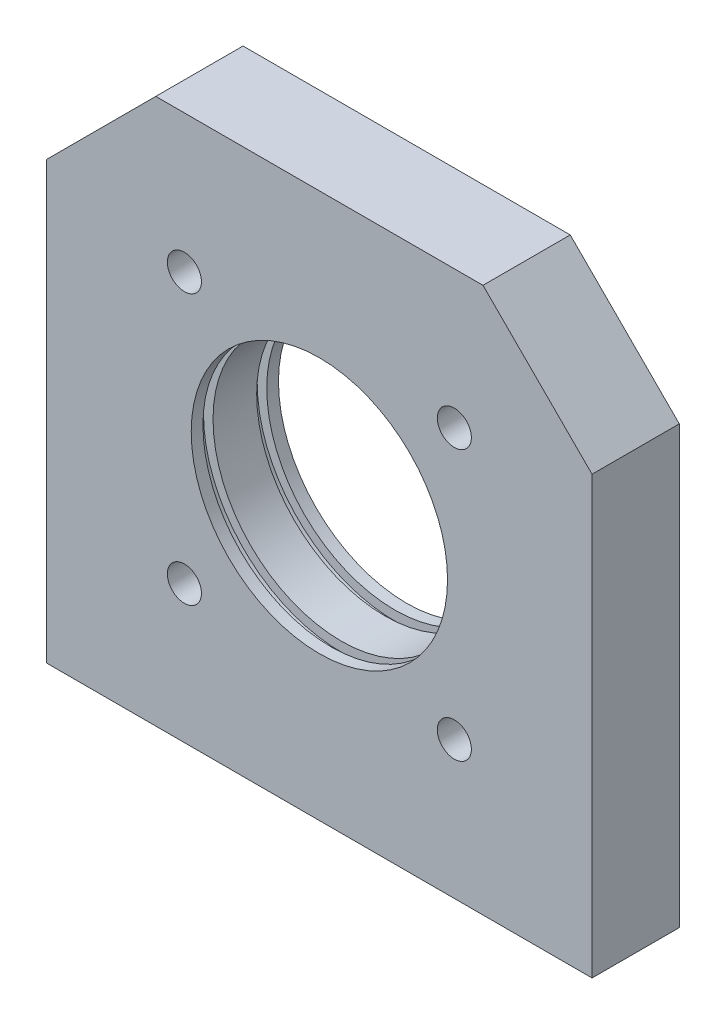
from build123d import *

# Parameters (mm, degrees)
SKETCH1_W                        = 100
SKETCH1_H                        = 100
BOSS_EXTRUDE1_DEPTH              = 16
CUT_EXTRUDE1_DEPTH               = 73.498275842
CUT_EXTRUDE1_DEPTH_BACK          = 73.498275842
SKETCH2_R                        = 23.5
SKETCH3_W                        = 1.85
SKETCH3_H                        = 1.75
TAP_DRILL_FOR_M6_HELICOIL1_D     = 6.25
TAP_DRILL_FOR_M6_HELICOIL1_DEPTH = 15
TAP_DRILL_FOR_M6_HELICOIL1_TIP   = 1.877689434
TAP_DRILL_FOR_M6_HELICOIL2_D     = 6.25
CHAMFER1_SIZE                    = 20


with BuildPart() as part:
    # Sketch1 → Boss-Extrude1 (new body)
    with BuildSketch(Plane.XY):
        Rectangle(SKETCH1_W, SKETCH1_H)
    extrude(amount=BOSS_EXTRUDE1_DEPTH)

    # Sketch2 → Cut-Extrude1 (cut, two sides: drawn at the far end of the back side and taken through both)
    with BuildSketch(Plane.XY.offset(16).offset(-CUT_EXTRUDE1_DEPTH_BACK)):
        Circle(SKETCH2_R)
    extrude(amount=CUT_EXTRUDE1_DEPTH + CUT_EXTRUDE1_DEPTH_BACK, mode=Mode.SUBTRACT)

    # Sketch3 → Cut-Revolve1 (revolve, cut)
    with BuildSketch(Plane(origin=(0, 0, 0), x_dir=(0, 0, -1), z_dir=(1, 0, 0)), mode=Mode.PRIVATE) as cut_revolve1_sk:
        with Locations((-12.925, 24.375)):
            Rectangle(SKETCH3_W, SKETCH3_H)
        with Locations((-3.075, 24.375)):
            Rectangle(SKETCH3_W, SKETCH3_H)
    revolve(cut_revolve1_sk.sketch.rotate(Axis((0, 0, 0), (0, 0, 1)), 90), axis=Axis((0, 0, 0), (0, 0, 1)), mode=Mode.SUBTRACT)

    # Tap Drill for M6 Helicoil1
    with Locations(Plane(origin=(0, -50, 0), x_dir=(-1, 0, 0), z_dir=(0, -1, 0))):
        with Locations((-40, -8), (0, -8), (40, -8)):
            Hole(TAP_DRILL_FOR_M6_HELICOIL1_D / 2, depth=TAP_DRILL_FOR_M6_HELICOIL1_DEPTH)
            with Locations((0, 0, -(TAP_DRILL_FOR_M6_HELICOIL1_DEPTH + TAP_DRILL_FOR_M6_HELICOIL1_TIP / 2))):  # 118° drill point
                Cone(0, TAP_DRILL_FOR_M6_HELICOIL1_D / 2, TAP_DRILL_FOR_M6_HELICOIL1_TIP, mode=Mode.SUBTRACT)

    # Tap Drill for M6 Helicoil2 (through all)
    with Locations(Plane(origin=(0, 0, 0), x_dir=(-1, 0, 0), z_dir=(0, 0, -1))):
        with Locations((-24.748737342, -24.748737342), (-24.748737342, 24.748737342), (24.748737342, 24.748737342), (24.748737342, -24.748737342)):
            Hole(TAP_DRILL_FOR_M6_HELICOIL2_D / 2)

    # Chamfer1
    chamfer1_edges = [part.edges().sort_by_distance(p)[0] for p in [
        (-50, 50, 8),
        (50, 50, 8),
    ]]
    chamfer(chamfer1_edges, length=CHAMFER1_SIZE)


solid = part.part
